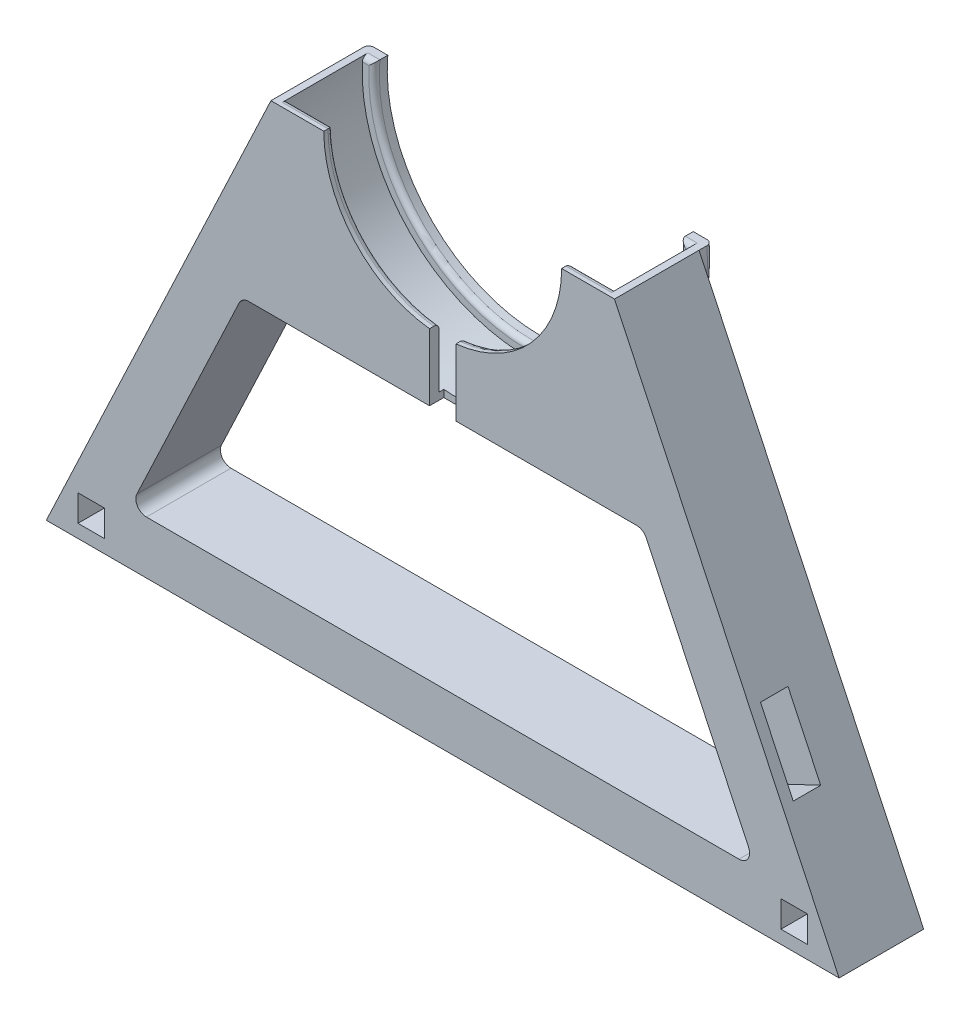
from build123d import *

# Parameters (mm, degrees)
BOSS_EXTRUDE1_DEPTH = 16
SKETCH2_R           = 31.25
CUT_EXTRUDE1_DEPTH  = 14.2
SKETCH3_R           = 22.5
CUT_EXTRUDE2_DEPTH  = 14.2
FILLET1_R           = 2
SKETCH4_W           = 5.2
SKETCH4_H           = 14.5
CUT_EXTRUDE3_DEPTH  = 10
SKETCH5_W           = 5
SKETCH5_H           = 5
CUT_EXTRUDE4_DEPTH  = 119.241278748
SKETCH6_W           = 5
SKETCH6_H           = 15
CUT_EXTRUDE5_DEPTH  = 2.7
BOSS_EXTRUDE2_DEPTH = 2.5
FILLET2_R           = 1
FILLET3_R           = 1


with BuildPart() as part:
    # Sketch1 → Boss-Extrude1 (new body)
    with BuildSketch(Plane.XY):
        Polygon((-75, 0), (75, 0), (32.5, 90), (-32.5, 90), align=None)
        Polygon((-59.218872646, 10), (-37.968872646, 55), (37.968872646, 55), (59.218872646, 10), align=None, mode=Mode.SUBTRACT)
    extrude(amount=BOSS_EXTRUDE1_DEPTH)

    # Sketch2 → Cut-Extrude1 (cut)
    with BuildSketch(Plane(origin=(0, 0, 0), x_dir=(-1, 0, 0), z_dir=(0, 0, -1))):
        with Locations((0, 87.5)):
            Circle(SKETCH2_R)
    extrude(amount=-CUT_EXTRUDE1_DEPTH, mode=Mode.SUBTRACT)

    # Sketch3 → Cut-Extrude2 (cut)
    with BuildSketch(Plane(origin=(0, 0, 14.2), x_dir=(-1, 0, 0), z_dir=(0, 0, -1))):
        with Locations((0, 90)):
            Circle(SKETCH3_R)
    extrude(amount=-CUT_EXTRUDE2_DEPTH, mode=Mode.SUBTRACT)

    # Fillet1
    fillet1_edges = [part.edges().sort_by_distance(p)[0] for p in [
        (59.218872646, 10, 8),
        (37.968872646, 55, 8),
        (-37.968872646, 55, 8),
        (-59.218872646, 10, 8),
    ]]
    fillet(fillet1_edges, radius=FILLET1_R)

    # Sketch4 → Cut-Extrude3 (cut)
    with BuildSketch(Plane(origin=(61.324921136, 28.958990536, 0), x_dir=(0, 0, -1), z_dir=(0.9042486467459909, 0.42700630540782925, 0))):
        with Locations((-11.4, 0.254673281)):
            Rectangle(SKETCH4_W, SKETCH4_H)
    extrude(amount=-CUT_EXTRUDE3_DEPTH, mode=Mode.SUBTRACT)

    # Sketch5 → Cut-Extrude4 (cut, through all)
    with BuildSketch(Plane(origin=(0, 0, 0), x_dir=(-1, 0, 0), z_dir=(0, 0, -1))):
        with Locations((-66.5, 5)):
            Rectangle(SKETCH5_W, SKETCH5_H)
        with Locations((66.5, 5)):
            Rectangle(SKETCH5_W, SKETCH5_H)
    extrude(amount=-CUT_EXTRUDE4_DEPTH, mode=Mode.SUBTRACT)

    # Sketch6 → Cut-Extrude5 (cut)
    with BuildSketch(Plane.XY.offset(16)):
        with Locations((0, 62.5)):
            Rectangle(SKETCH6_W, SKETCH6_H)
    extrude(amount=-CUT_EXTRUDE5_DEPTH, mode=Mode.SUBTRACT)

    # Sketch7 → Boss-Extrude2 (add)
    with BuildSketch(Plane(origin=(0, 0, 0), x_dir=(-1, 0, 0), z_dir=(0, 0, -1))):
        with BuildLine():
            Line((-32.5, 90), (-28.892040426, 90))
            ThreePointArc((-28.892040426, 90), (0, 58.5), (28.892040426, 90))
            Line((28.892040426, 90), (32.5, 90))
            ThreePointArc((32.5, 90), (0, 54.903987974), (-32.5, 90))
        make_face()
    extrude(amount=BOSS_EXTRUDE2_DEPTH)

    # Fillet2
    fillet2_edges = [part.edges().sort_by_distance(p)[0] for p in [
        (0, 54.903987974, -2.5),
    ]]
    fillet(fillet2_edges, radius=FILLET2_R)

    # Fillet3
    fillet3_edges = [part.edges().sort_by_distance(p)[0] for p in [
        (-16.770509831, 75, 14.2),
        (-30.020939956, 90, 0),
        (0, 58.5, 0),
        (30.020939956, 90, 0),
        (-26.824919743, 90, 14.2),
        (26.824919743, 90, 14.2),
        (16.770509831, 75, 14.2),
    ]]
    fillet(fillet3_edges, radius=FILLET3_R)


solid = part.part
